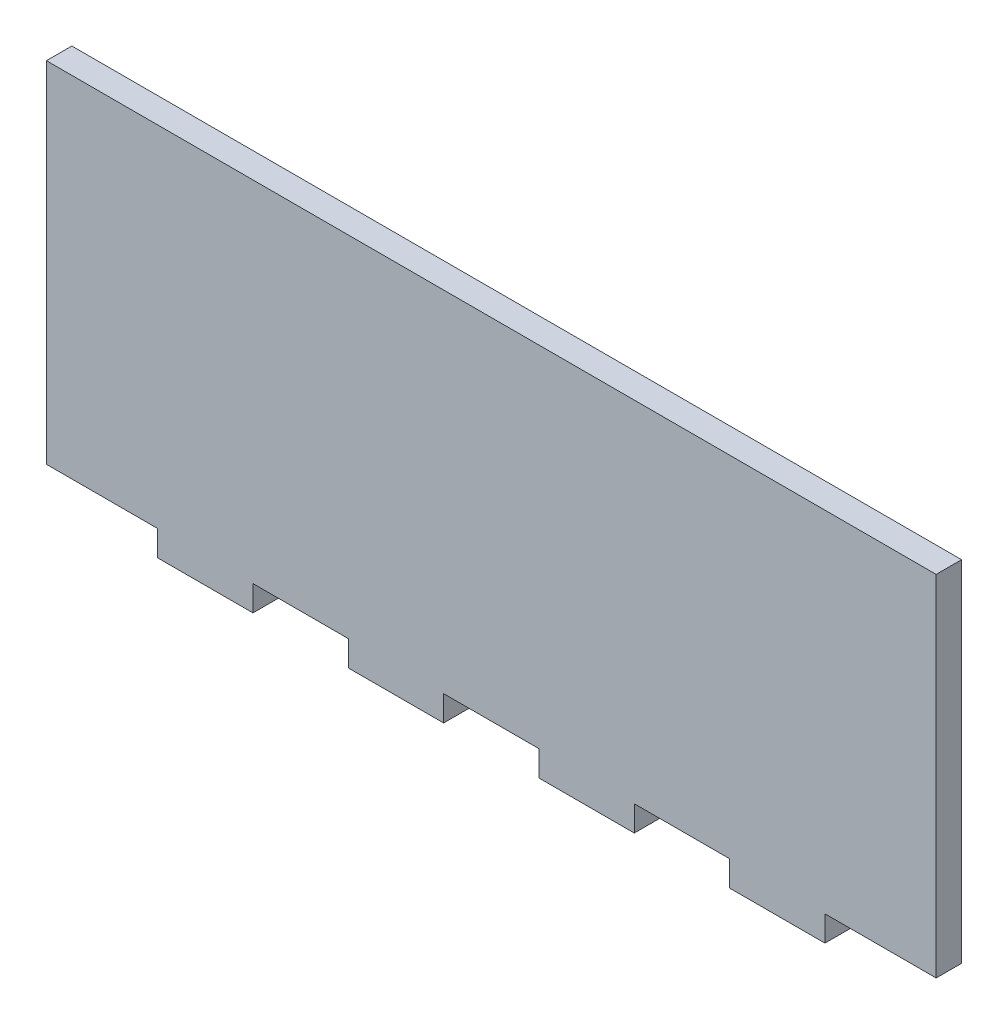
from build123d import *

# Parameters (mm, degrees)
SKETCH1_W           = 140
SKETCH1_H           = 4
BOSS_EXTRUDE1_DEPTH = 55
SKETCH2_W           = 15
SKETCH2_H           = 4
BOSS_EXTRUDE2_DEPTH = 4


with BuildPart() as part:
    # Sketch1 → Boss-Extrude1 (new body)
    with BuildSketch(Plane(origin=(0, 0, 0), x_dir=(1, 0, 0), z_dir=(0, 1, 0))):
        Rectangle(SKETCH1_W, SKETCH1_H)
    extrude(amount=BOSS_EXTRUDE1_DEPTH)

    # Sketch2 → Boss-Extrude2 (add)
    with BuildSketch(Plane(origin=(0, 0, 0), x_dir=(-1, 0, 0), z_dir=(0, -1, 0))):
        with Locations((45, 0)):
            Rectangle(SKETCH2_W, SKETCH2_H)
        with Locations((15, 0)):
            Rectangle(SKETCH2_W, SKETCH2_H)
        with Locations((-15, 0)):
            Rectangle(SKETCH2_W, SKETCH2_H)
        with Locations((-45, 0)):
            Rectangle(SKETCH2_W, SKETCH2_H)
    extrude(amount=BOSS_EXTRUDE2_DEPTH)


solid = part.part
